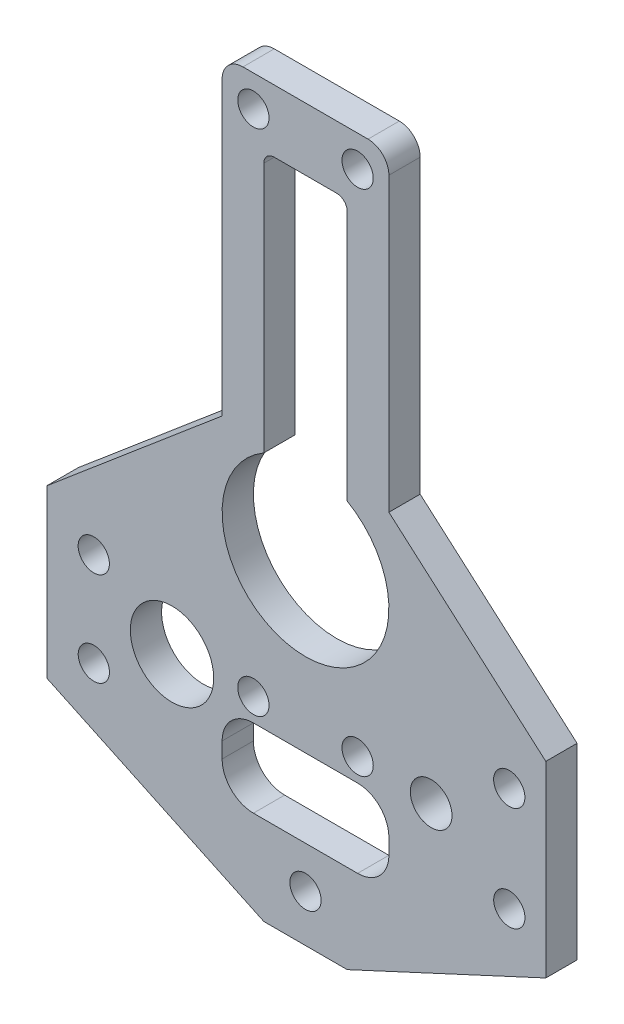
from build123d import *

# Parameters (mm, degrees)
SKETCH1_R           = 1.5
SKETCH1_R_2         = 4
SKETCH1_R_3         = 2
BOSS_EXTRUDE1_DEPTH = 3


with BuildPart() as part:
    # Sketch1 → Boss-Extrude1 (new body)
    with BuildSketch(Plane.XY):
        with BuildLine():
            Line((-6, 70), (6, 70))
            ThreePointArc((6, 70), (7.414213562, 69.414213562), (8, 68))
            Line((8, 68), (8, 40))
            Line((8, 40), (23.052765378, 26.831315386))
            Line((23.052765378, 26.831315386), (23.052765378, 8.831315386))
            Line((23.052765378, 8.831315386), (4, 0))
            Line((4, 0), (-4, 0))
            Line((-4, 0), (-24.806216128, 9.803130645))
            Line((-24.806216128, 9.803130645), (-24.806216128, 25.803130645))
            Line((-24.806216128, 25.803130645), (-8, 40))
            Line((-8, 40), (-8, 68))
            ThreePointArc((-8, 68), (-7.414213562, 69.414213562), (-6, 70))
        make_face()
        with Locations((0, 4.5)):
            Circle(SKETCH1_R, mode=Mode.SUBTRACT)
        with Locations((-20.306216128, 13.303130645)):
            Circle(SKETCH1_R, mode=Mode.SUBTRACT)
        with Locations(Location((-20.311519457, 22.308427732, 0), (0, 0, 180))):
            Circle(SKETCH1_R, mode=Mode.SUBTRACT)
        with Locations((-12.806216128, 17.810197592)):
            Circle(SKETCH1_R_2, mode=Mode.SUBTRACT)
        with Locations((-5, 67)):
            Circle(SKETCH1_R, mode=Mode.SUBTRACT)
        with Locations(Location((5, 67, 0), (0, 0, 180))):
            Circle(SKETCH1_R, mode=Mode.SUBTRACT)
        with Locations((5, 18.2)):
            Circle(SKETCH1_R, mode=Mode.SUBTRACT)
        with Locations(Location((-5, 18.2, 0), (0, 0, 180))):
            Circle(SKETCH1_R, mode=Mode.SUBTRACT)
        with Locations((19.552765378, 12.829253326)):
            Circle(SKETCH1_R, mode=Mode.SUBTRACT)
        with Locations(Location((19.546876257, 22.829251592, 0), (0, 0, 180))):
            Circle(SKETCH1_R, mode=Mode.SUBTRACT)
        with Locations((12.052765378, 17.824837351)):
            Circle(SKETCH1_R_3, mode=Mode.SUBTRACT)
        with BuildLine():
            Line((-3, 64), (3, 64))
            ThreePointArc((3, 64), (3.707106781, 63.707106781), (4, 63))
            Line((4, 63), (4, 38.92820323))
            ThreePointArc((4, 38.92820323), (0, 24), (-4, 38.92820323))
            Line((-4, 38.92820323), (-4, 63))
            ThreePointArc((-4, 63), (-3.707106781, 63.707106781), (-3, 64))
        make_face(mode=Mode.SUBTRACT)
        with BuildLine():
            Line((-5, 16), (5, 16))
            ThreePointArc((5, 16), (7.121320344, 15.121320344), (8, 13))
            Line((8, 13), (8, 11.5))
            ThreePointArc((8, 11.5), (7.121320344, 9.378679656), (5, 8.5))
            Line((5, 8.5), (-5, 8.5))
            ThreePointArc((-5, 8.5), (-7.121320344, 9.378679656), (-8, 11.5))
            Line((-8, 11.5), (-8, 13))
            ThreePointArc((-8, 13), (-7.121320344, 15.121320344), (-5, 16))
        make_face(mode=Mode.SUBTRACT)
    extrude(amount=BOSS_EXTRUDE1_DEPTH)


solid = part.part
